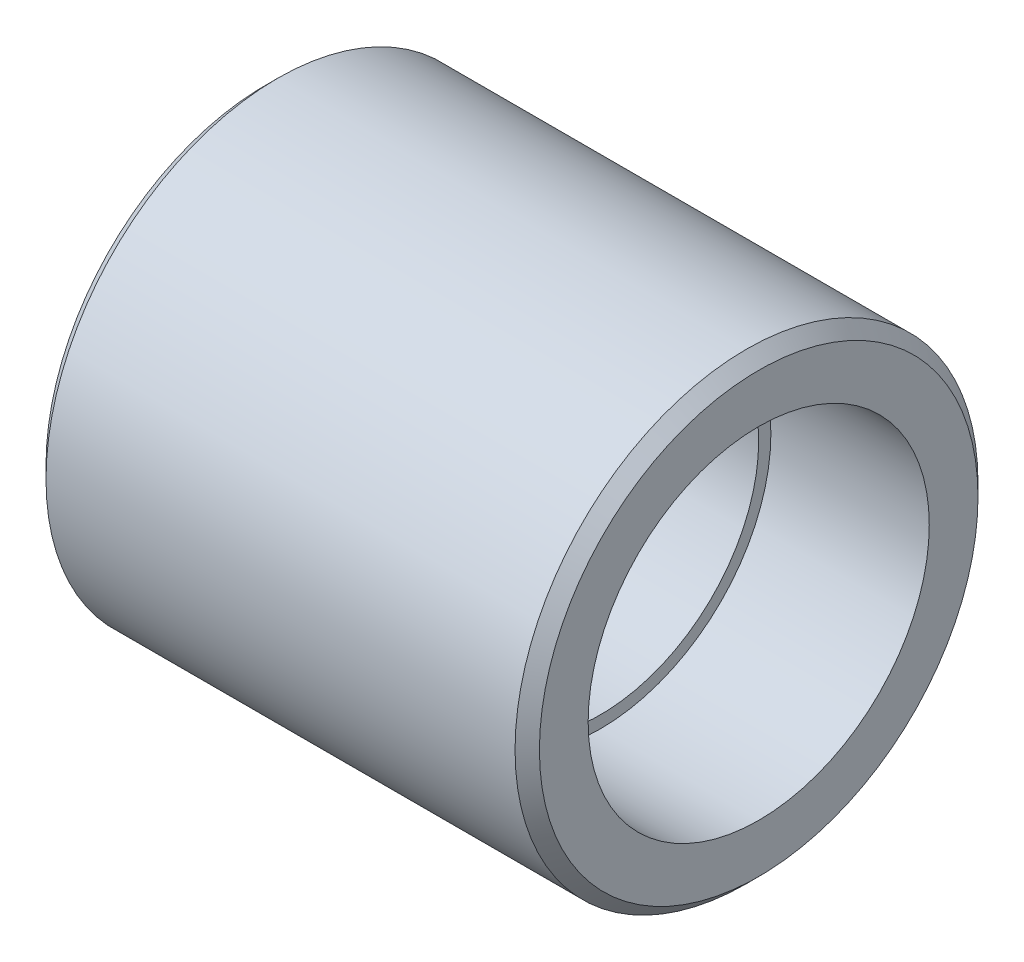
from build123d import *


with BuildPart() as part:
    # Esquisse1 → Base-Révolution (revolve)
    with BuildSketch(Plane.XY, mode=Mode.PRIVATE) as base_r_volution_sk:
        Polygon((0, 18), (0, 16), (10, 16), (10, 13), (27.5, 13), (27.5, 14), (40.5, 14), (40.5, 18), (39.5, 19), (1, 19), align=None)
    revolve(base_r_volution_sk.sketch.rotate(Axis((0, 0, 0), (1, 0, 0)), 90), axis=Axis((0, 0, 0), (1, 0, 0)))


solid = part.part
